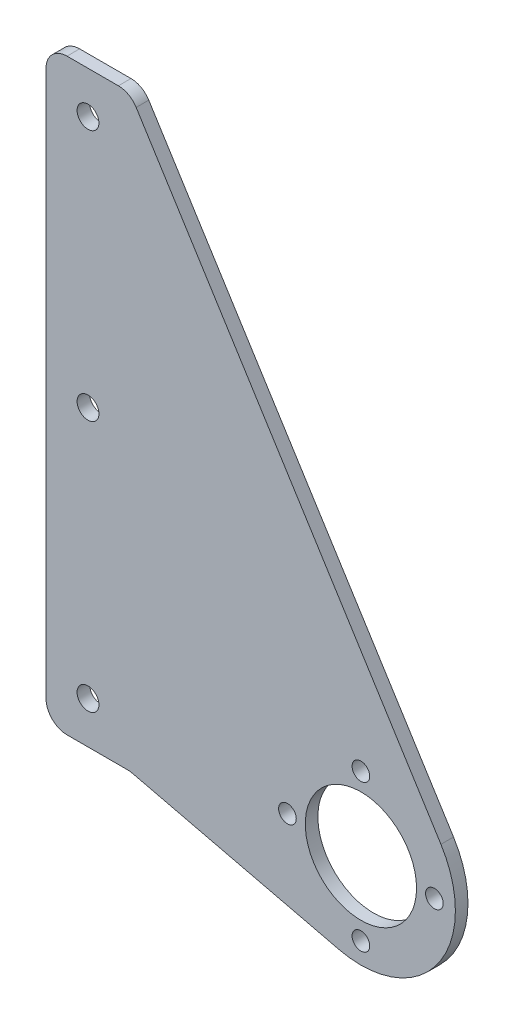
from build123d import *

# Parameters (mm, degrees)
SKETCH_2_R      = 13.25
SKETCH_2_R_2    = 2.1
SKETCH_2_R_3    = 2.6
EXTRUDE_1_DEPTH = 3
FILLET_3_R      = 5


with BuildPart() as part:
    # ｽｹｯﾁ2 → ﾎﾞｽ - 押し出し1 (new body)
    with BuildSketch(Plane.XY):
        with BuildLine():
            Line((-75, 130), (-75, -10))
            Line((-75, -10), (-55, -10))
            Line((-55, -10), (-5.225491892, -21.884794596))
            ThreePointArc((-5.225491892, -21.884794596), (18.280450485, -13.117741043), (19.059394587, 11.957820787))
            Line((19.059394587, 11.957820787), (-55, 130))
            Line((-55, 130), (-75, 130))
        make_face()
        Circle(SKETCH_2_R, mode=Mode.SUBTRACT)
        with Locations((0, 17.5)):
            Circle(SKETCH_2_R_2, mode=Mode.SUBTRACT)
        with Locations((17.5, 0)):
            Circle(SKETCH_2_R_2, mode=Mode.SUBTRACT)
        with Locations((0, -17.5)):
            Circle(SKETCH_2_R_2, mode=Mode.SUBTRACT)
        with Locations((-17.5, 0)):
            Circle(SKETCH_2_R_2, mode=Mode.SUBTRACT)
        with Locations((-65, 60)):
            Circle(SKETCH_2_R_3, mode=Mode.SUBTRACT)
        with Locations((-65, 120)):
            Circle(SKETCH_2_R_3, mode=Mode.SUBTRACT)
        with Locations((-65, 0)):
            Circle(SKETCH_2_R_3, mode=Mode.SUBTRACT)
    extrude(amount=EXTRUDE_1_DEPTH)

    # ﾌｨﾚｯﾄ3
    fillet_3_edges = [part.edges().sort_by_distance(p)[0] for p in [
        (-55, 130, 1.5),
        (-55, -10, 1.5),
        (-75, -10, 1.5),
        (-75, 130, 1.5),
    ]]
    fillet(fillet_3_edges, radius=FILLET_3_R)


solid = part.part
